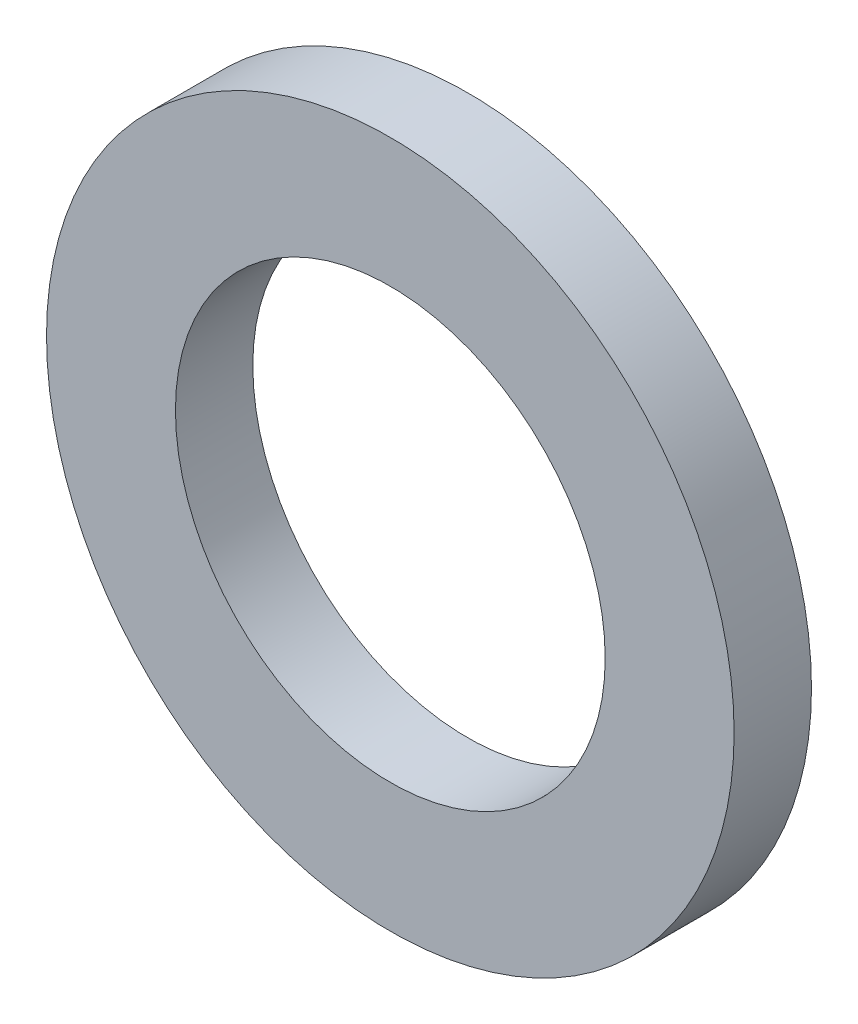
from build123d import *

# Parameters (mm, degrees)
BOSS_EXTRUDE1_DEPTH      = 1.35
BOSS_EXTRUDE1_DEPTH_BACK = 1.35
SKETCH3_R                = 12
SKETCH3_R_2              = 7.5


with BuildPart() as part:
    # Sketch3 → Boss-Extrude1 (new, two sides: drawn at the far end of the back side and taken through both)
    with BuildSketch(Plane.XY.offset(-BOSS_EXTRUDE1_DEPTH_BACK)):
        Circle(SKETCH3_R)
        Circle(SKETCH3_R_2, mode=Mode.SUBTRACT)
    extrude(amount=BOSS_EXTRUDE1_DEPTH + BOSS_EXTRUDE1_DEPTH_BACK)


solid = part.part
